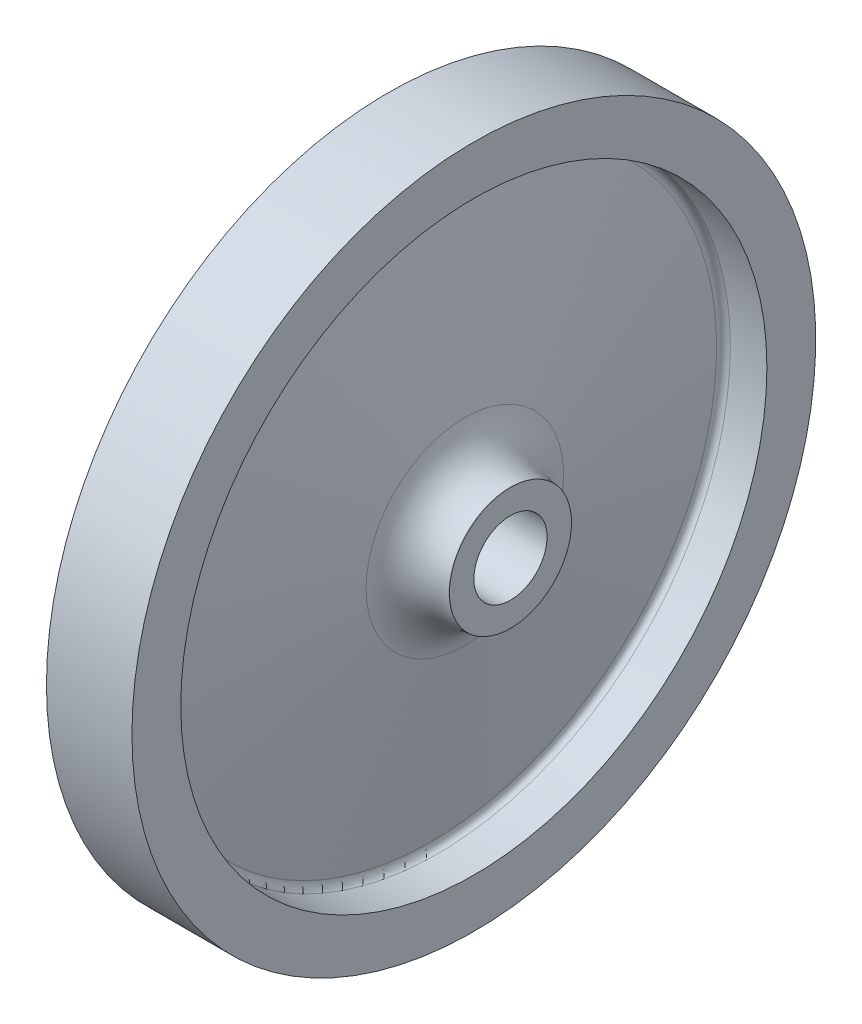
from build123d import *


with BuildPart() as part:
    # Sketch2 → Revolve1 (revolve)
    with BuildSketch(Plane.XY, mode=Mode.PRIVATE) as revolve1_sk:
        with BuildLine():
            Line((-24.319148936, 9.525), (7.430851064, 9.525))
            Line((7.430851064, 9.525), (7.430851064, 15.875))
            Line((7.430851064, 15.875), (7.316402096, 15.875))
            ThreePointArc((7.316402096, 15.875), (-0.336356408, 18.650515004), (-4.430671947, 25.686478088))
            Line((-4.430671947, 25.686478088), (-13.222804096, 74.254906544))
            ThreePointArc((-13.222804096, 74.254906544), (-12.86536093, 75.607360219), (-11.59820875, 76.2))
            Line((-11.59820875, 76.2), (-2.094148936, 76.2))
            Line((-2.094148936, 76.2), (-2.094148936, 88.9))
            Line((-2.094148936, 88.9), (-24.319148936, 88.9))
            Line((-24.319148936, 88.9), (-24.319148936, 76.2))
            Line((-24.319148936, 76.2), (-23.449860757, 76.2))
            ThreePointArc((-23.449860757, 76.2), (-22.391500538, 75.81615218), (-21.82526541, 74.843093456))
            Line((-21.82526541, 74.843093456), (-11.692237493, 18.867451471))
            ThreePointArc((-11.692237493, 18.867451471), (-12.242150056, 16.78675351), (-14.191614948, 15.875))
            Line((-14.191614948, 15.875), (-24.319148936, 15.875))
            Line((-24.319148936, 15.875), (-24.319148936, 9.525))
        make_face()
    revolve(revolve1_sk.sketch.rotate(Axis((-25.028457447, 0, 0), (1, 0, 0)), 90), axis=Axis((-25.028457447, 0, 0), (1, 0, 0)))


solid = part.part
